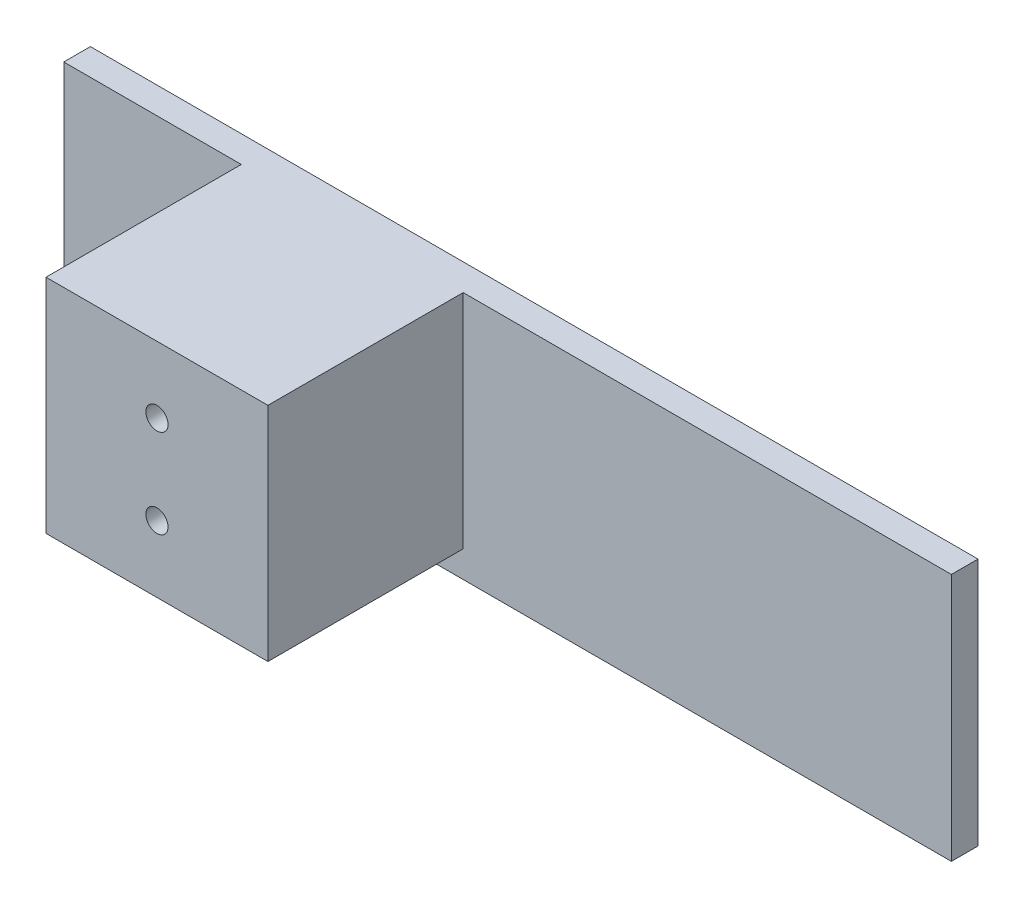
from build123d import *

# Parameters (mm, degrees)
ESQUISSE1_W             = 25
ESQUISSE1_H             = 25
BOSS_EXTRU_1_DEPTH      = 22
ESQUISSE2_R             = 1.25
ENL_V_MAT_EXTRU_1_DEPTH = 15
ESQUISSE3_W             = 100
ESQUISSE3_H             = 28
BOSS_EXTRU_2_DEPTH      = 3


with BuildPart() as part:
    # Esquisse1 → Boss.-Extru.1 (new body)
    with BuildSketch(Plane.XY):
        with Locations((-4.734848485, 0.757575758)):
            Rectangle(ESQUISSE1_W, ESQUISSE1_H)
    extrude(amount=BOSS_EXTRU_1_DEPTH)

    # Esquisse2 → Enlèv. mat.-Extru.1 (cut)
    with BuildSketch(Plane.XY.offset(22)):
        with Locations((-4.734848485, 5.757575758)):
            Circle(ESQUISSE2_R)
        with Locations((-4.734848485, -4.242424242)):
            Circle(ESQUISSE2_R)
    extrude(amount=-ENL_V_MAT_EXTRU_1_DEPTH, mode=Mode.SUBTRACT)

    # Esquisse3 → Boss.-Extru.2 (add)
    with BuildSketch(Plane(origin=(0, 0, 0), x_dir=(-1, 0, 0), z_dir=(0, 0, -1))):
        with Locations((-12.765151515, -0.742424242)):
            Rectangle(ESQUISSE3_W, ESQUISSE3_H)
    extrude(amount=BOSS_EXTRU_2_DEPTH)


solid = part.part
